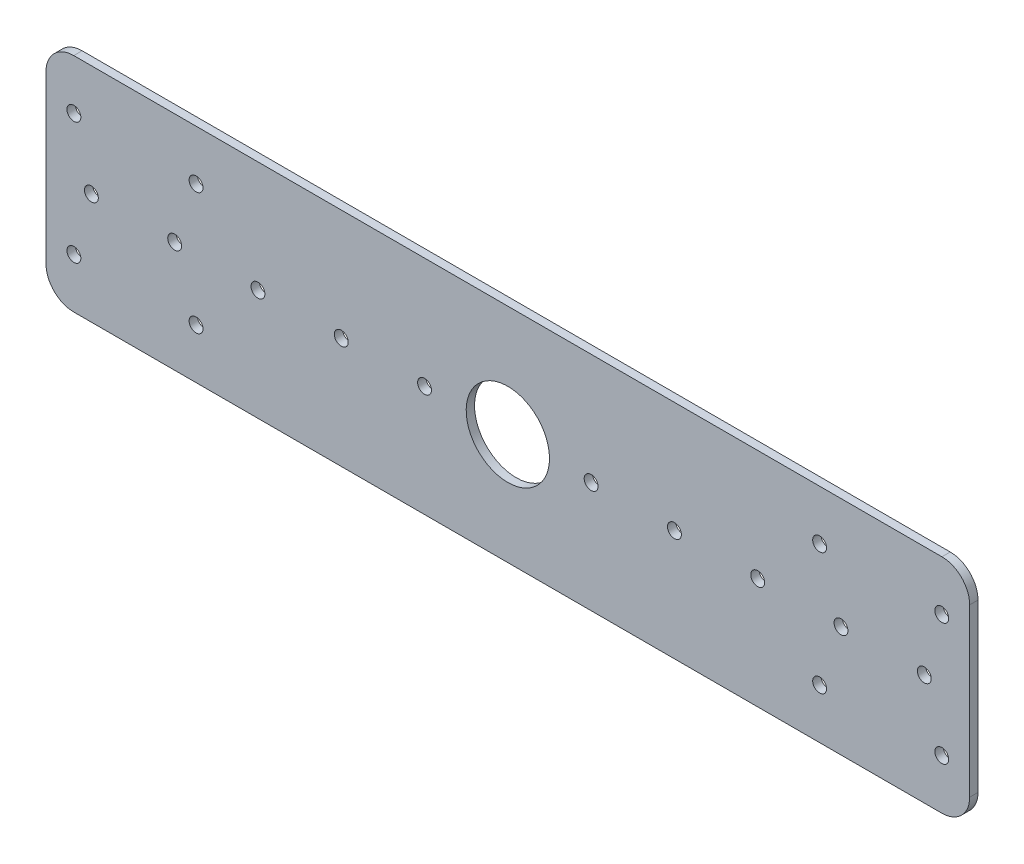
from build123d import *

# Parameters (mm, degrees)
SKETCH_2_W          = 332.68587988
SKETCH_2_H          = 71.0001569
EXTRUDE_1_DEPTH     = 3
SKETCH_6_R          = 15
CUT_EXTRUDE_1_DEPTH = 10
SKETCH_7_R          = 2.5
CUT_EXTRUDE_2_DEPTH = 10
SKETCH_8_W          = 332.68587988
SKETCH_8_H          = 4.49992155
EXTRUDE_2_DEPTH     = 3
FILLET_1_R          = 10
SKETCH_9_R          = 2.5
CUT_EXTRUDE_3_DEPTH = 308.13402677


with BuildPart() as part:
    # 草图2 → 凸台-拉伸1 (new body)
    with BuildSketch(Plane(origin=(0, 0, 0), x_dir=(1, 0, 0), z_dir=(0, -2.59377104206923e-08, 0.9999999999999998))):
        with Locations((-82.5, -139.998615632)):
            Rectangle(SKETCH_2_W, SKETCH_2_H)
    extrude(amount=EXTRUDE_1_DEPTH)

    # 草图6 → 切除-拉伸1 (cut)
    with BuildSketch(Plane(origin=(0, -7.8e-08, 3), x_dir=(1, 0, 0), z_dir=(0, -2.5937710420692294e-08, 0.9999999999999998))):
        with Locations(Location((-82.5, -139.998615632, 0), (0, 0, 270))):
            Circle(SKETCH_6_R)
    extrude(amount=-CUT_EXTRUDE_1_DEPTH, mode=Mode.SUBTRACT)

    # 草图7 → 切除-拉伸2 (cut)
    with BuildSketch(Plane(origin=(0, 0, 0), x_dir=(-1, 0, 0), z_dir=(0, 2.5937710420692294e-08, -0.9999999999999998))):
        with Locations(Location((238.799997941, -117.998615632, 0), (0, 0, 90))):
            Circle(SKETCH_7_R)
        with Locations(Location((194.799997941, -117.998615632, 0), (0, 0, 90))):
            Circle(SKETCH_7_R)
        with Locations(Location((194.79999794, -161.998615632, 0), (0, 0, 90))):
            Circle(SKETCH_7_R)
        with Locations(Location((238.799997941, -161.998615632, 0), (0, 0, 90))):
            Circle(SKETCH_7_R)
        with Locations(Location((-73.79999794, -161.998615632, 0), (0, 0, 270))):
            Circle(SKETCH_7_R)
        with Locations(Location((-29.79999794, -161.998615632, 0), (0, 0, 270))):
            Circle(SKETCH_7_R)
        with Locations(Location((-29.79999794, -117.998615632, 0), (0, 0, 270))):
            Circle(SKETCH_7_R)
        with Locations(Location((-73.79999794, -117.998615632, 0), (0, 0, 270))):
            Circle(SKETCH_7_R)
    extrude(amount=-CUT_EXTRUDE_2_DEPTH, mode=Mode.SUBTRACT)

    # 草图8 → 凸台-拉伸2 (add)
    with BuildSketch(Plane(origin=(0, -7.8e-08, 3), x_dir=(1, 0, 0), z_dir=(0, -2.5937710420692294e-08, 0.9999999999999998))):
        with Locations((-82.5, -102.248576407)):
            Rectangle(SKETCH_8_W, SKETCH_8_H)
        with Locations((-82.5, -177.748654857)):
            Rectangle(SKETCH_8_W, SKETCH_8_H)
    extrude(amount=-EXTRUDE_2_DEPTH)

    # 圆角1
    fillet_1_edges = [part.edges().sort_by_distance(p)[0] for p in [
        (-248.84293994, -99.998615671, 1.499997406),
        (83.84293994, -99.998615671, 1.499997406),
        (83.84293994, -179.998615671, 1.499995331),
        (-248.84293994, -179.998615671, 1.499995331),
    ]]
    fillet(fillet_1_edges, radius=FILLET_1_R)

    # 草图9 → 切除-拉伸3 (cut, through all)
    with BuildSketch(Plane(origin=(0, 0, 0), x_dir=(-1, 0, 0), z_dir=(0, 2.5937710420692294e-08, -0.9999999999999998))):
        with Locations(Location((202.5, -139.998615632, 0), (0, 0, 90))):
            Circle(SKETCH_9_R)
        with Locations(Location((172.5, -139.998615632, 0), (0, 0, 90))):
            Circle(SKETCH_9_R)
        with Locations(Location((142.5, -139.998615632, 0), (0, 0, 90))):
            Circle(SKETCH_9_R)
        with Locations(Location((112.5, -139.998615632, 0), (0, 0, 90))):
            Circle(SKETCH_9_R)
        with Locations(Location((52.5, -139.998615632, 0), (0, 0, 90))):
            Circle(SKETCH_9_R)
        with Locations(Location((22.5, -139.998615632, 0), (0, 0, 90))):
            Circle(SKETCH_9_R)
        with Locations(Location((-7.5, -139.998615632, 0), (0, 0, 90))):
            Circle(SKETCH_9_R)
        with Locations(Location((-37.5, -139.998615632, 0), (0, 0, 90))):
            Circle(SKETCH_9_R)
        with Locations(Location((-67.5, -139.998615632, 0), (0, 0, 90))):
            Circle(SKETCH_9_R)
        with Locations(Location((232.5, -139.998615632, 0), (0, 0, 90))):
            Circle(SKETCH_9_R)
    extrude(amount=-CUT_EXTRUDE_3_DEPTH, mode=Mode.SUBTRACT)


solid = part.part
